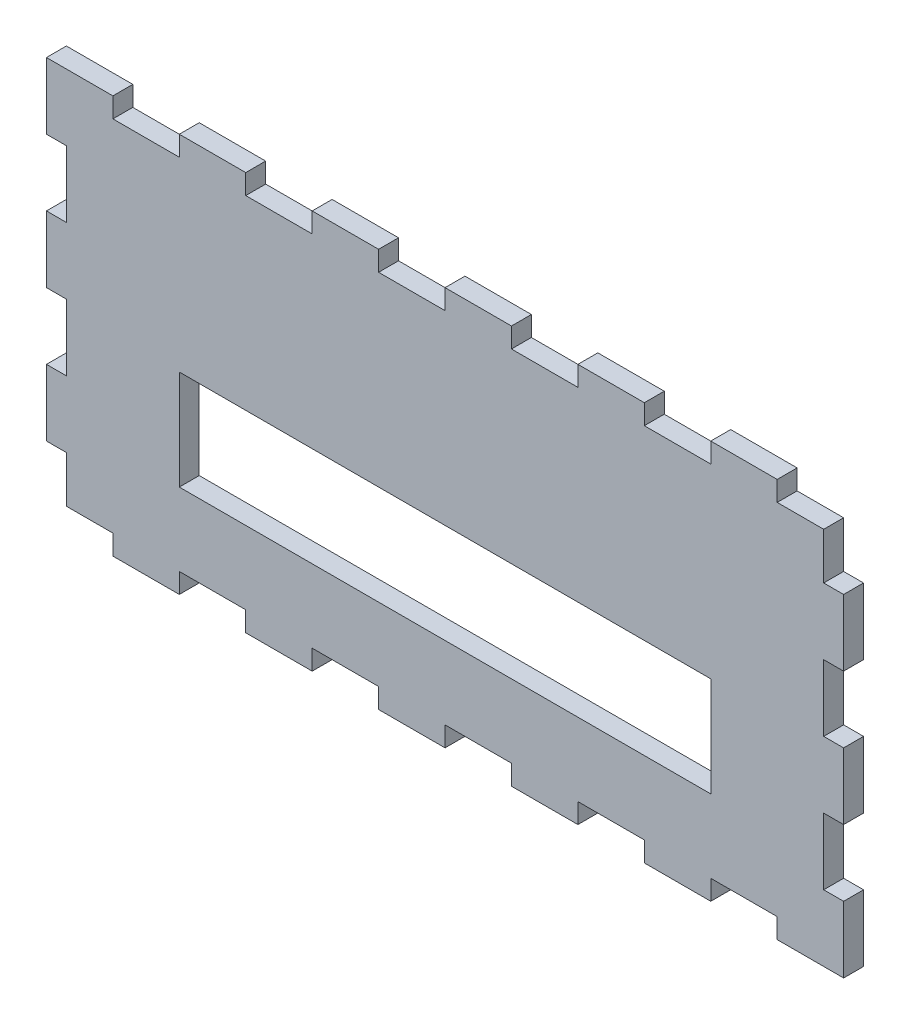
from build123d import *

# Parameters (mm, degrees)
BOSS_EXTRUDE1_DEPTH = 3
SKETCH2_W           = 80
SKETCH2_H           = 15
CUT_EXTRUDE1_DEPTH  = 10


with BuildPart() as part:
    # Sketch1 → Boss-Extrude1 (new body)
    with BuildSketch(Plane.XY):
        Polygon((120, 0), (120, 10), (117, 10), (117, 20), (120, 20), (120, 30), (117, 30), (117, 40), (120, 40), (120, 50), (117, 50), (117, 57), (110, 57), (110, 60), (100, 60), (100, 57), (90, 57), (90, 60), (80, 60), (80, 57), (70, 57), (70, 60), (60, 60), (60, 57), (50, 57), (50, 60), (40, 60), (40, 57), (30, 57), (30, 60), (20, 60), (20, 57), (10, 57), (10, 60), (0, 60), (0, 50), (3, 50), (3, 40), (0, 40), (0, 30), (3, 30), (3, 20), (0, 20), (0, 10), (3, 10), (3, 3), (10, 3), (10, 0), (20, 0), (20, 3), (30, 3), (30, 0), (40, 0), (40, 3), (50, 3), (50, 0), (60, 0), (60, 3), (70, 3), (70, 0), (80, 0), (80, 3), (90, 3), (90, 0), (100, 0), (100, 3), (110, 3), (110, 0), align=None)
    extrude(amount=BOSS_EXTRUDE1_DEPTH)

    # Sketch2 → Cut-Extrude1 (cut)
    with BuildSketch(Plane.XY.offset(3)):
        with Locations((60, 21.5)):
            Rectangle(SKETCH2_W, SKETCH2_H)
    extrude(amount=-CUT_EXTRUDE1_DEPTH, mode=Mode.SUBTRACT)


solid = part.part
